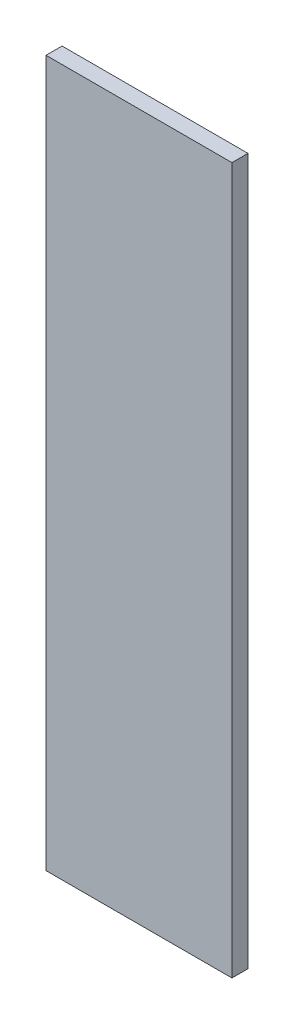
from build123d import *

# Parameters (mm, degrees)
SKETCH1_W           = 220.726
SKETCH1_H           = 838.2
BOSS_EXTRUDE1_DEPTH = 19.05


with BuildPart() as part:
    # Sketch1 → Boss-Extrude1 (new body)
    with BuildSketch(Plane.XY):
        with Locations((110.363, 419.1)):
            Rectangle(SKETCH1_W, SKETCH1_H)
    extrude(amount=BOSS_EXTRUDE1_DEPTH)


solid = part.part
